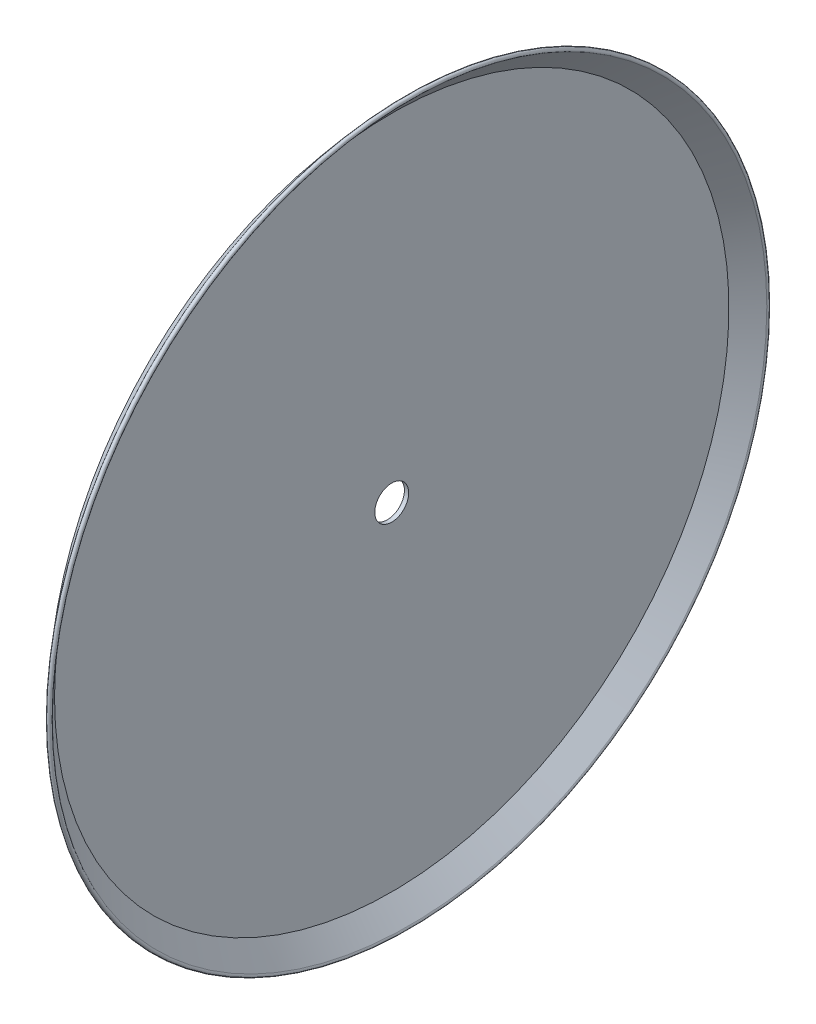
from build123d import *

# Parameters (mm, degrees)
SKETCH3_R          = 4
CUT_EXTRUDE2_DEPTH = 10


with BuildPart() as part:
    # Sketch1 → Revolve2 (revolve)
    with BuildSketch(Plane.XY, mode=Mode.PRIVATE) as revolve2_sk:
        with BuildLine():
            Line((-57.012917733, 0), (-57.012917733, 79.757128962))
            Line((-57.012917733, 79.757128962), (-52.540300867, 85))
            ThreePointArc((-52.540300867, 85), (-51.833944752, 85.032573588), (-51.801371164, 84.326217473))
            Line((-51.801371164, 84.326217473), (-56.012917733, 79.601675105))
            Line((-56.012917733, 79.601675105), (-56.012917733, 0))
            Line((-56.012917733, 0), (-57.012917733, 0))
        make_face()
    revolve(revolve2_sk.sketch.rotate(Axis((-57.012917733, 0, 0), (1, 0, 0)), 90), axis=Axis((-57.012917733, 0, 0), (1, 0, 0)))

    # Sketch3 → Cut-Extrude2 (cut)
    with BuildSketch(Plane(origin=(-56.012917733, 0, 0), x_dir=(0, 0, -1), z_dir=(1, 0, 0))):
        Circle(SKETCH3_R)
    extrude(amount=-CUT_EXTRUDE2_DEPTH, mode=Mode.SUBTRACT)


solid = part.part
